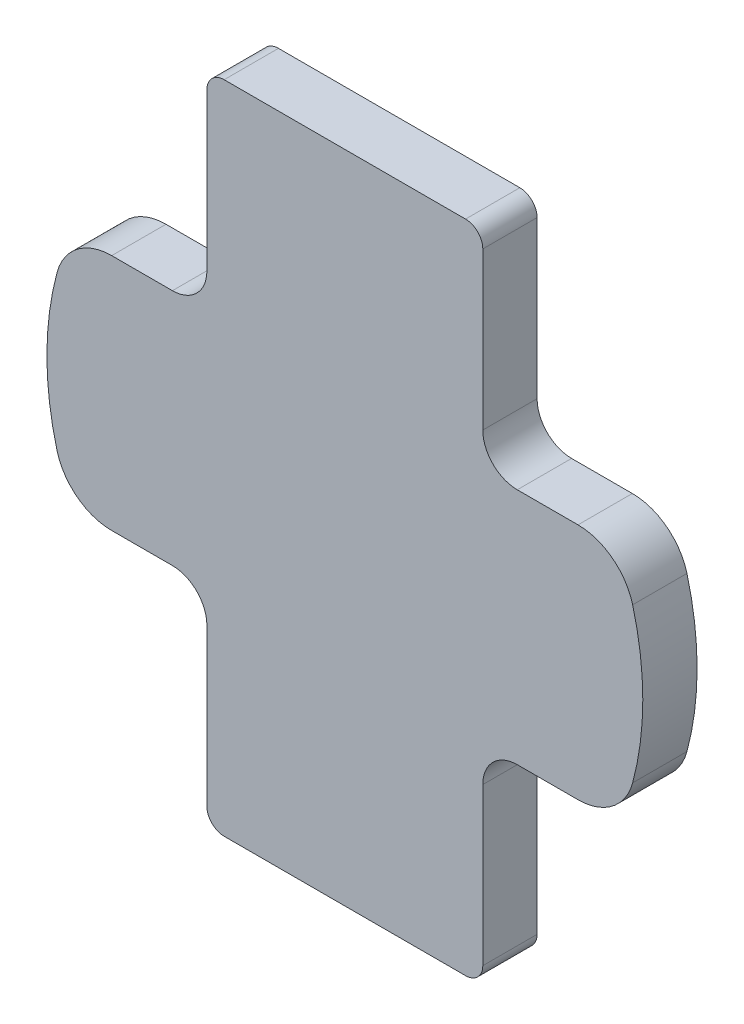
from build123d import *

# Parameters (mm, degrees)
BOSS_EXTRUDE1_DEPTH = 10


with BuildPart() as part:
    # Sketch1 → Boss-Extrude1 (new body)
    with BuildSketch(Plane.XY):
        with BuildLine():
            Line((-25.4, -57.15), (-25.4, -28.26893))
            ThreePointArc((-25.4, -28.26893), (-27.259871939, -23.778801939), (-31.75, -21.91893))
            Line((-31.75, -21.91893), (-42.935289515, -21.91893))
            ThreePointArc((-42.935289515, -21.91893), (-49.274890295, -19.766942948), (-52.994414486, -14.200370743))
            ThreePointArc((-52.994414486, -14.200370743), (-54.864, 0), (-52.994414486, 14.200370743))
            ThreePointArc((-52.994414486, 14.200370743), (-49.274890295, 19.766942948), (-42.935289515, 21.91893))
            Line((-42.935289515, 21.91893), (-31.75, 21.91893))
            ThreePointArc((-31.75, 21.91893), (-27.259871939, 23.778801939), (-25.4, 28.26893))
            Line((-25.4, 28.26893), (-25.4, 57.15))
            ThreePointArc((-25.4, 57.15), (-24.47006403, 59.39506403), (-22.225, 60.325))
            Line((-22.225, 60.325), (22.225, 60.325))
            ThreePointArc((22.225, 60.325), (24.47006403, 59.39506403), (25.4, 57.15))
            Line((25.4, 57.15), (25.4, 28.26893))
            ThreePointArc((25.4, 28.26893), (27.259871939, 23.778801939), (31.75, 21.91893))
            Line((31.75, 21.91893), (42.935289515, 21.91893))
            ThreePointArc((42.935289515, 21.91893), (49.274890295, 19.766942948), (52.994414486, 14.200370743))
            ThreePointArc((52.994414486, 14.200370743), (54.864, 0), (52.994414486, -14.200370743))
            ThreePointArc((52.994414486, -14.200370743), (49.274890295, -19.766942948), (42.935289515, -21.91893))
            Line((42.935289515, -21.91893), (31.75, -21.91893))
            ThreePointArc((31.75, -21.91893), (27.259871939, -23.778801939), (25.4, -28.26893))
            Line((25.4, -28.26893), (25.4, -57.15))
            ThreePointArc((25.4, -57.15), (24.47006403, -59.39506403), (22.225, -60.325))
            Line((22.225, -60.325), (-22.225, -60.325))
            ThreePointArc((-22.225, -60.325), (-24.47006403, -59.39506403), (-25.4, -57.15))
        make_face()
    extrude(amount=BOSS_EXTRUDE1_DEPTH)


solid = part.part
